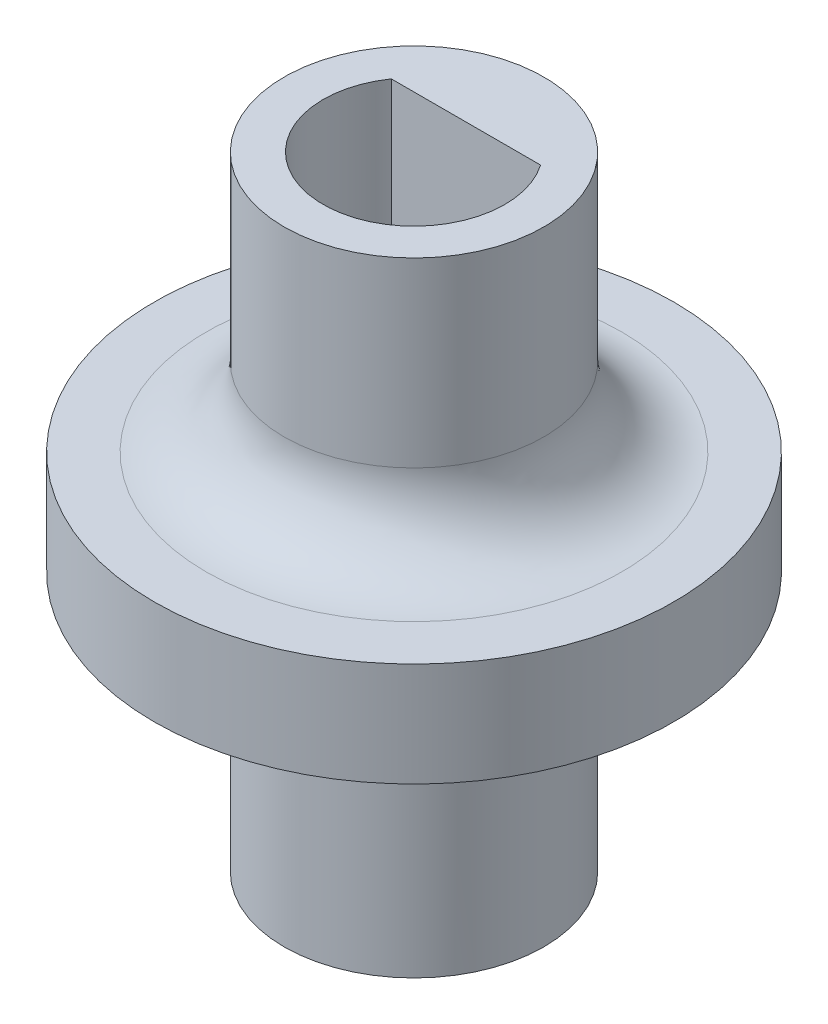
from build123d import *

# Parameters (mm, degrees)
CROQUIS1_R              = 10
SALIENTE_EXTRUIR1_DEPTH = 2
CROQUIS2_R              = 5
SALIENTE_EXTRUIR2_DEPTH = 10
CORTAR_EXTRUIR1_DEPTH   = 8
SALIENTE_EXTRUIR3_START = 10
CROQUIS4_R              = 5
SALIENTE_EXTRUIR3_DEPTH = 10
REDONDEO1_R             = 3
CORTAR_EXTRUIR2_DEPTH   = 9


with BuildPart() as part:
    # Croquis1 → Saliente-Extruir1 (new, symmetric)
    with BuildSketch(Plane(origin=(0, 0, 0), x_dir=(1, 0, 0), z_dir=(0, 1, 0))):
        with Locations(Location((0, 0, 0), (0, 0, 270))):
            Circle(CROQUIS1_R)
    extrude(amount=SALIENTE_EXTRUIR1_DEPTH, both=True)

    # Croquis2 → Saliente-Extruir2 (add)
    with BuildSketch(Plane(origin=(0, 2, 0), x_dir=(1, 0, 0), z_dir=(0, 1, 0))):
        with Locations(Location((0, 0, 0), (0, 0, 270))):
            Circle(CROQUIS2_R)
    extrude(amount=SALIENTE_EXTRUIR2_DEPTH)

    # Croquis3 → Cortar-Extruir1 (cut)
    with BuildSketch(Plane(origin=(0, 12, 0), x_dir=(1, 0, 0), z_dir=(0, 1, 0))):
        with BuildLine():
            Line((-2.872281323, 2), (2.872281323, 2))
            ThreePointArc((2.872281323, 2), (0, -3.5), (-2.872281323, 2))
        make_face()
    extrude(amount=-CORTAR_EXTRUIR1_DEPTH, mode=Mode.SUBTRACT)

    # Croquis4 → Saliente-Extruir3 (add)
    with BuildSketch(Plane(origin=(0, -2, 0), x_dir=(-1, 0, 0), z_dir=(0, -1, 0)).offset(SALIENTE_EXTRUIR3_START)):
        with Locations(Location((0, 0, 0), (0, 0, 270))):
            Circle(CROQUIS4_R)
    extrude(amount=-SALIENTE_EXTRUIR3_DEPTH)

    # Redondeo1
    redondeo1_edges = [part.edges().sort_by_distance(p)[0] for p in [
        (0, -2, -5),
        (0, 2, -5),
    ]]
    fillet(redondeo1_edges, radius=REDONDEO1_R)

    # Croquis5 → Cortar-Extruir2 (cut)
    with BuildSketch(Plane.XZ.offset(12)):
        with BuildLine():
            Line((-2.1914607, 2.4), (2.1914607, 2.4))
            ThreePointArc((2.1914607, 2.4), (3.25, 0), (2.1914607, -2.4))
            Line((2.1914607, -2.4), (-2.1914607, -2.4))
            ThreePointArc((-2.1914607, -2.4), (-3.25, 0), (-2.1914607, 2.4))
        make_face()
    extrude(amount=-CORTAR_EXTRUIR2_DEPTH, mode=Mode.SUBTRACT)


solid = part.part
